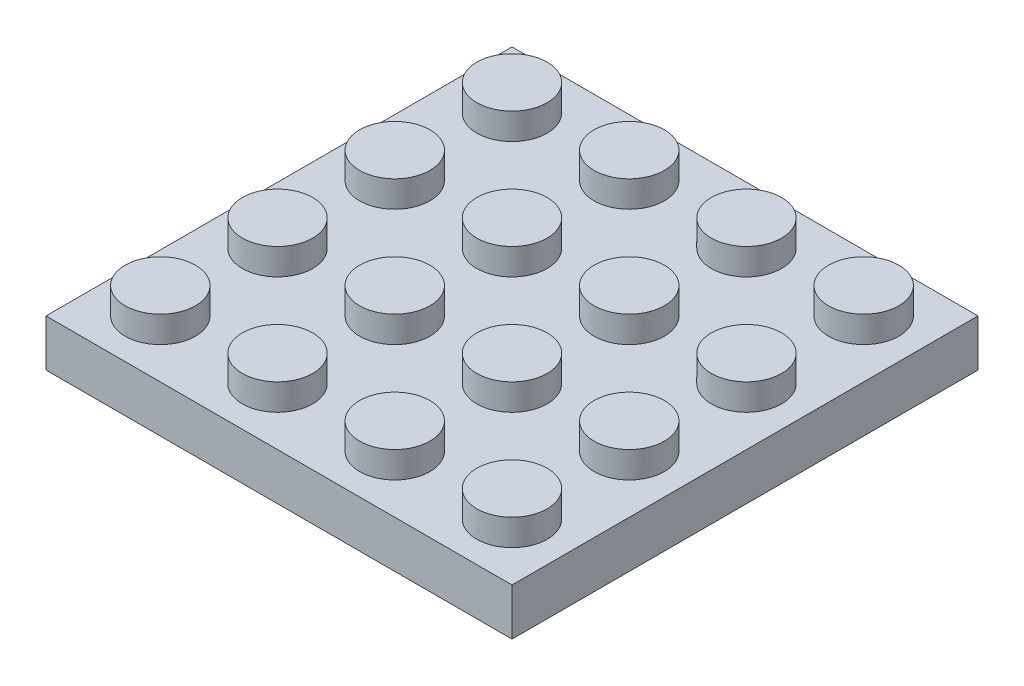
from build123d import *

# Parameters (mm, degrees)
SKETCH1_W            = 31.8
SKETCH1_H            = 31.8
BOSS_EXTRUDE1_DEPTH  = 3.2
SKETCH2_R            = 2.4
BOSS_EXTRUDE2_DEPTH  = 1.8
LPATTERN1_COUNT      = 4
LPATTERN1_PITCH      = 8
LPATTERN1_COUNT_DIR2 = 4
LPATTERN1_PITCH_DIR2 = 8
SHELL1_T             = -1.2
SKETCH3_R            = 3.25
SKETCH3_R_2          = 2.4
BOSS_EXTRUDE3_DEPTH  = 2
LPATTERN2_COUNT      = 3
LPATTERN2_PITCH      = 8
LPATTERN2_COUNT_DIR2 = 3
LPATTERN2_PITCH_DIR2 = 8


with BuildPart() as part:
    # Sketch1 → Boss-Extrude1 (new body)
    with BuildSketch(Plane(origin=(0, 0, 0), x_dir=(1, 0, 0), z_dir=(0, 1, 0))):
        Rectangle(SKETCH1_W, SKETCH1_H)
    extrude(amount=BOSS_EXTRUDE1_DEPTH)

    # Sketch2 → Boss-Extrude2 (add)
    with BuildSketch(Plane(origin=(0, 3.2, 0), x_dir=(1, 0, 0), z_dir=(0, 1, 0))):
        with Locations(Location((-12, -12, 0), (0, 0, 90))):
            Circle(SKETCH2_R)
    boss_extrude2 = extrude(amount=BOSS_EXTRUDE2_DEPTH)

    # LPattern1: Boss-Extrude2 4 × 4
    with Locations(*[(i * LPATTERN1_PITCH, 0, -j * LPATTERN1_PITCH_DIR2) for i in range(LPATTERN1_COUNT) for j in range(LPATTERN1_COUNT_DIR2) if (i, j) != (0, 0)]):
        add(boss_extrude2)

    # Shell1
    shell1_openings = [part.faces().sort_by_distance(p)[0] for p in [
        (0, 0, 0),
    ]]
    offset(amount=SHELL1_T, openings=shell1_openings, kind=Kind.INTERSECTION)

    # Sketch3 → Boss-Extrude3 (add)
    with BuildSketch(Plane.XZ.offset(-2)):
        with Locations(Location((-8, 8, 0), (0, 0, 270))):
            Circle(SKETCH3_R)
        with Locations(Location((-8, 8, 0), (0, 0, 270))):
            Circle(SKETCH3_R_2, mode=Mode.SUBTRACT)
    boss_extrude3 = extrude(amount=BOSS_EXTRUDE3_DEPTH)

    # LPattern2: Boss-Extrude3 3 × 3
    with Locations(*[(i * LPATTERN2_PITCH, 0, -j * LPATTERN2_PITCH_DIR2) for i in range(LPATTERN2_COUNT) for j in range(LPATTERN2_COUNT_DIR2) if (i, j) != (0, 0)]):
        add(boss_extrude3)


solid = part.part
